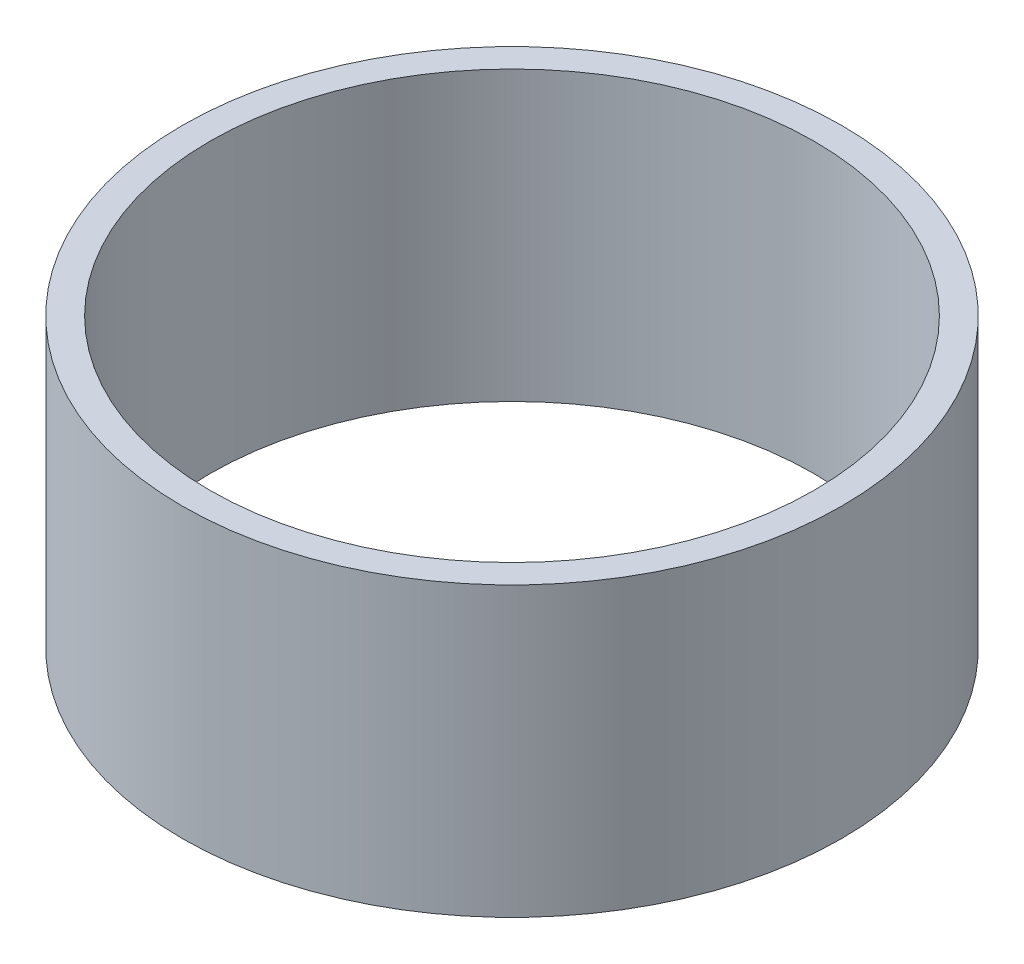
from build123d import *

# Parameters (mm, degrees)
SKETCH1_R           = 76.2
SKETCH1_R_2         = 69.85
BOSS_EXTRUDE1_DEPTH = 33.274


with BuildPart() as part:
    # Sketch1 → Boss-Extrude1 (new, symmetric)
    with BuildSketch(Plane(origin=(0, 0, 0), x_dir=(1, 0, 0), z_dir=(0, 1, 0))):
        with Locations(Location((0, 0, 0), (0, 0, 270))):
            Circle(SKETCH1_R)
        with Locations(Location((0, 0, 0), (0, 0, 270))):
            Circle(SKETCH1_R_2, mode=Mode.SUBTRACT)
    extrude(amount=BOSS_EXTRUDE1_DEPTH, both=True)


solid = part.part
